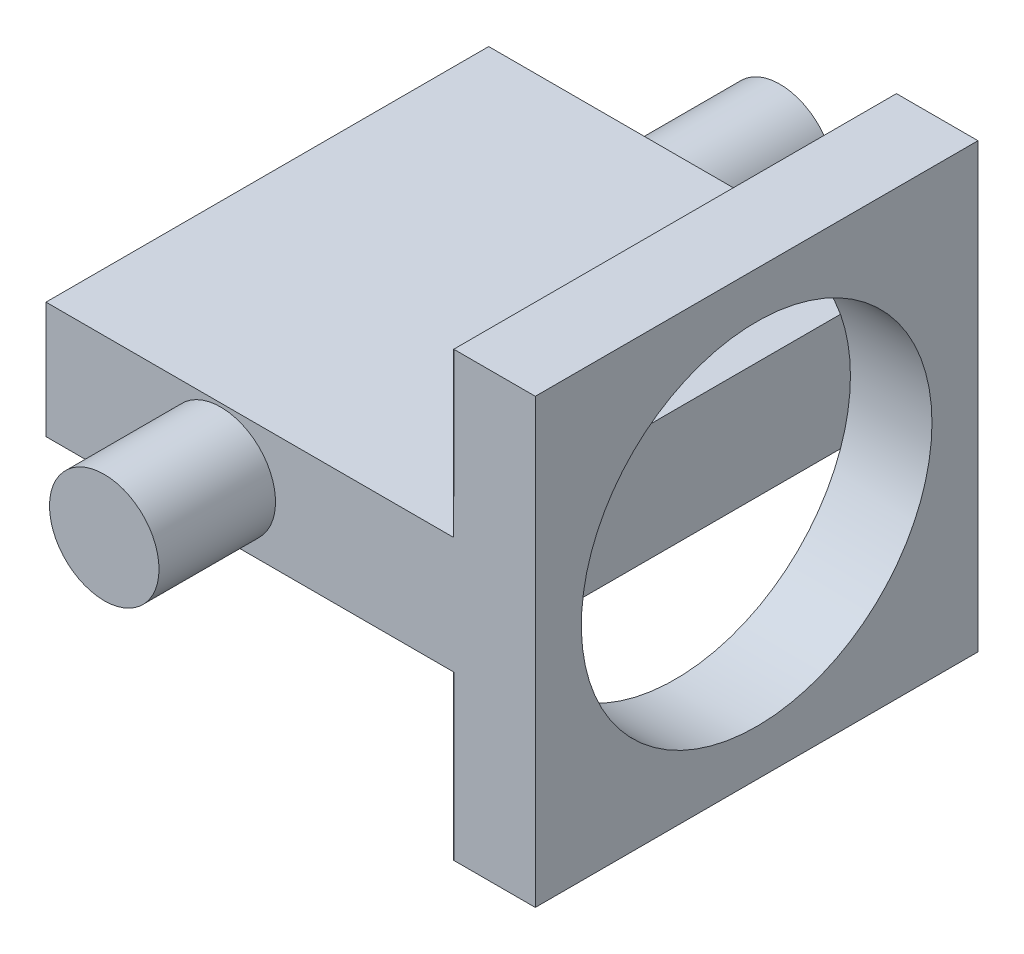
from build123d import *

# Parameters (mm, degrees)
SKETCH1_W           = 38
SKETCH1_H           = 38
SKETCH1_R           = 15.05
BOSS_EXTRUDE1_DEPTH = 7
SKETCH2_W           = 38
SKETCH2_H           = 10
BOSS_EXTRUDE2_DEPTH = 35
SKETCH3_R           = 4.7
BOSS_EXTRUDE3_DEPTH = 10


with BuildPart() as part:
    # Sketch1 → Boss-Extrude1 (new body)
    with BuildSketch(Plane(origin=(0, 0, 0), x_dir=(0, 0, -1), z_dir=(1, 0, 0))):
        Rectangle(SKETCH1_W, SKETCH1_H)
        Circle(SKETCH1_R, mode=Mode.SUBTRACT)
    extrude(amount=BOSS_EXTRUDE1_DEPTH)

    # Sketch2 → Boss-Extrude2 (add)
    with BuildSketch(Plane.ZY):
        Rectangle(SKETCH2_W, SKETCH2_H)
    extrude(amount=BOSS_EXTRUDE2_DEPTH)

    # Sketch3 → Boss-Extrude3 (add)
    with BuildSketch(Plane.XY.offset(19)):
        with Locations(Location((-20, 0, 0), (0, 0, 180))):
            Circle(SKETCH3_R)
    boss_extrude3 = extrude(amount=BOSS_EXTRUDE3_DEPTH)

    # Mirror1: Boss-Extrude3 across plane
    add(boss_extrude3.mirror(Plane.XY))


solid = part.part
